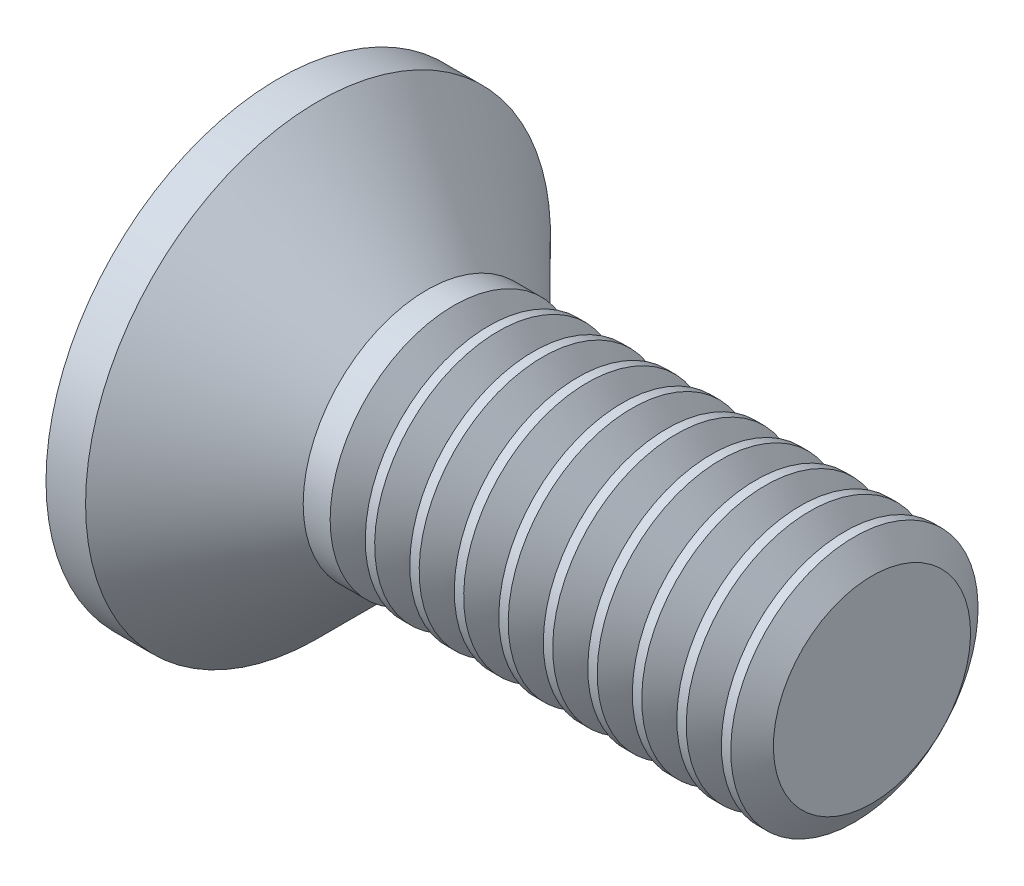
from build123d import *

# Parameters (mm, degrees)
CIRPATTERN1_COUNT = 2
CIRPATTERN1_ANGLE = 90
THDSCHPAT_COUNT   = 10
THDSCHPAT_PITCH   = 0.45


with BuildPart() as part:
    # BodySke → Base-Revolve (revolve)
    with BuildSketch(Plane.XY, mode=Mode.PRIVATE) as base_revolve_sk:
        Polygon((0, 0), (0, 2.35), (0.4, 2.35), (1.5, 1.25), (6, 1.25), (6, 0), align=None)
    revolve(base_revolve_sk.sketch.rotate(Axis((-6.35, 0, 0), (1, 0, 0)), 90), axis=Axis((-6.35, 0, 0), (1, 0, 0)))

    # Sketch3 → Cross section 0
    with BuildSketch(Plane.ZY):
        with BuildLine():
            Line((-0.37, 1.4), (0.37, 1.4))
            Line((0.37, 1.4), (0.37, -1.4))
            Line((0.37, -1.4), (-0.37, -1.4))
            Line((-0.37, -1.4), (-0.37, 1.4))
        make_face()
    # Sketch4 → Cross section 1
    with BuildSketch(Plane.ZY.offset(-1.78)):
        with BuildLine():
            Line((-0.185, 0.185), (0.185, 0.185))
            Line((0.185, 0.185), (0.185, -0.185))
            Line((0.185, -0.185), (-0.185, -0.185))
            Line((-0.185, -0.185), (-0.185, 0.185))
        make_face()
    cross = loft(mode=Mode.SUBTRACT)

    # CirPattern1: Cross ×2 about axis
    cirpattern1_axis = Axis((0, 0, 0), (1, 0, 0))
    for i in range(1, CIRPATTERN1_COUNT):
        add(cross.rotate(cirpattern1_axis, i * CIRPATTERN1_ANGLE / (CIRPATTERN1_COUNT - 1)), mode=Mode.SUBTRACT)

    # ThdSchSke → ThreadSchematic (revolve, cut)
    with BuildSketch(Plane.XY):
        Polygon((1.950001, -0.9965), (1.772498389, -1.25), (1.772498389, -1.5625), (2.127503611, -1.5625), (2.127503611, -1.25), align=None)
    threadschematic = revolve(axis=Axis((-3.175, 0, 0), (1, 0, 0)), mode=Mode.SUBTRACT)

    # ThdSchPat: ThreadSchematic ×10
    with Locations(*[(i * THDSCHPAT_PITCH, 0, 0) for i in range(1, THDSCHPAT_COUNT)]):
        add(threadschematic, mode=Mode.SUBTRACT)


solid = part.part
